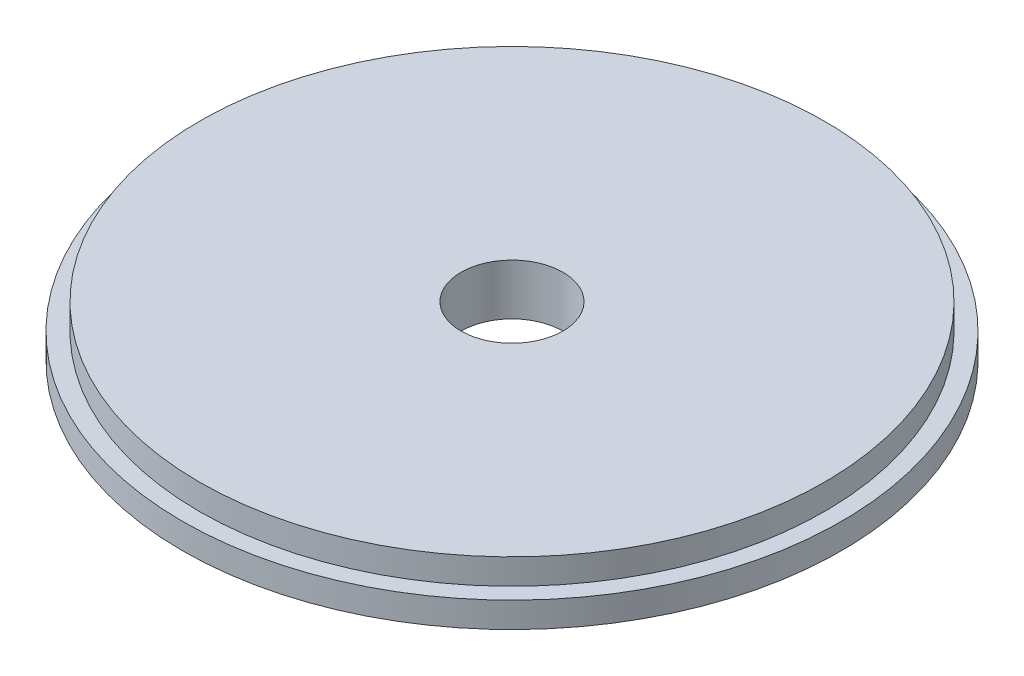
from build123d import *

# Parameters (mm, degrees)
SKETCH1_R           = 19.4
BOSS_EXTRUDE1_DEPTH = 1.5
SKETCH2_R           = 18.4
BOSS_EXTRUDE2_DEPTH = 1.5
SKETCH3_R           = 3
CUT_EXTRUDE1_DEPTH  = 3


with BuildPart() as part:
    # Sketch1 → Boss-Extrude1 (new body)
    with BuildSketch(Plane(origin=(0, 0, 0), x_dir=(1, 0, 0), z_dir=(0, 1, 0))):
        with Locations(Location((0, 0, 0), (0, 0, 270))):
            Circle(SKETCH1_R)
    extrude(amount=BOSS_EXTRUDE1_DEPTH)

    # Sketch2 → Boss-Extrude2 (add)
    with BuildSketch(Plane(origin=(0, 1.5, 0), x_dir=(1, 0, 0), z_dir=(0, 1, 0))):
        with Locations(Location((0, 0, 0), (0, 0, 270))):
            Circle(SKETCH2_R)
    extrude(amount=BOSS_EXTRUDE2_DEPTH)

    # Sketch3 → Cut-Extrude1 (cut)
    with BuildSketch(Plane(origin=(0, 3, 0), x_dir=(1, 0, 0), z_dir=(0, 1, 0))):
        with Locations(Location((0, 0, 0), (0, 0, 270))):
            Circle(SKETCH3_R)
    extrude(amount=-CUT_EXTRUDE1_DEPTH, mode=Mode.SUBTRACT)


solid = part.part
